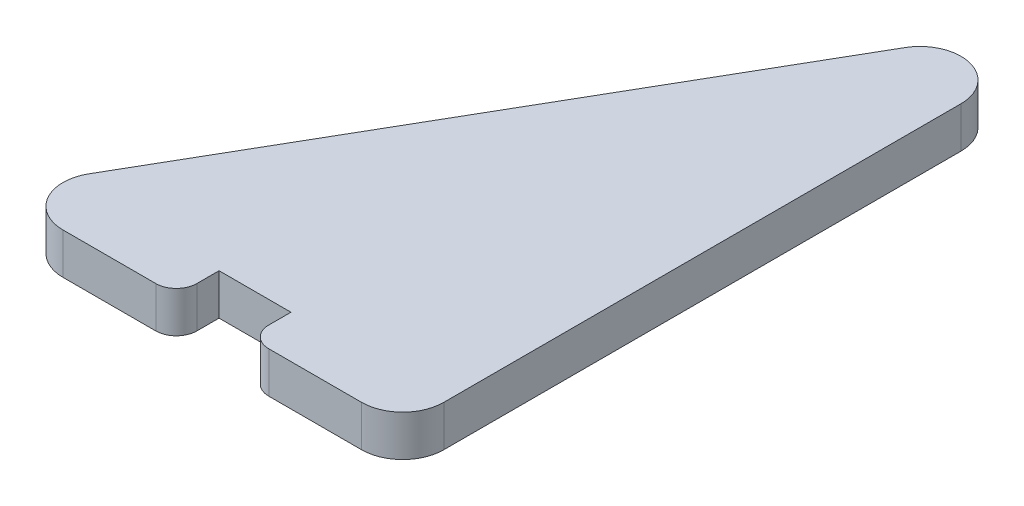
from build123d import *

# Parameters (mm, degrees)
BOSS_EXTRUDE1_DEPTH = 6.35
CUT_EXTRUDE1_DEPTH  = 110.933515147


with BuildPart() as part:
    # Sketch1 → Boss-Extrude1 (new body)
    with BuildSketch(Plane(origin=(0, 0, 0), x_dir=(1, 0, 0), z_dir=(0, 1, 0))):
        with BuildLine():
            Line((0, 6.35), (0, 86.286703653))
            ThreePointArc((0, 86.286703653), (-4.706499064, 92.420332649), (-11.849261314, 89.461703653))
            Line((-11.849261314, 89.461703653), (-58.000738686, 9.525))
            ThreePointArc((-58.000738686, 9.525), (-58.000738686, 3.175), (-52.501477372, 0))
            Line((-52.501477372, 0), (-6.35, 0))
            ThreePointArc((-6.35, 0), (-1.859871939, 1.859871939), (0, 6.35))
        make_face()
    extrude(amount=BOSS_EXTRUDE1_DEPTH)

    # Sketch3 → Cut-Extrude1 (cut, through all)
    with BuildSketch(Plane.XZ):
        with BuildLine():
            Line((-23.869488686, -6.604), (-34.981988686, -6.604))
            Line((-34.981988686, -6.604), (-34.981988686, -3.175))
            ThreePointArc((-34.981988686, -3.175), (-35.911924656, -0.92993597), (-38.156988686, 0))
            Line((-38.156988686, 0), (-20.694488686, 0))
            ThreePointArc((-20.694488686, 0), (-22.939552716, -0.92993597), (-23.869488686, -3.175))
            Line((-23.869488686, -3.175), (-23.869488686, -6.604))
        make_face()
    extrude(amount=-CUT_EXTRUDE1_DEPTH, mode=Mode.SUBTRACT)


solid = part.part
